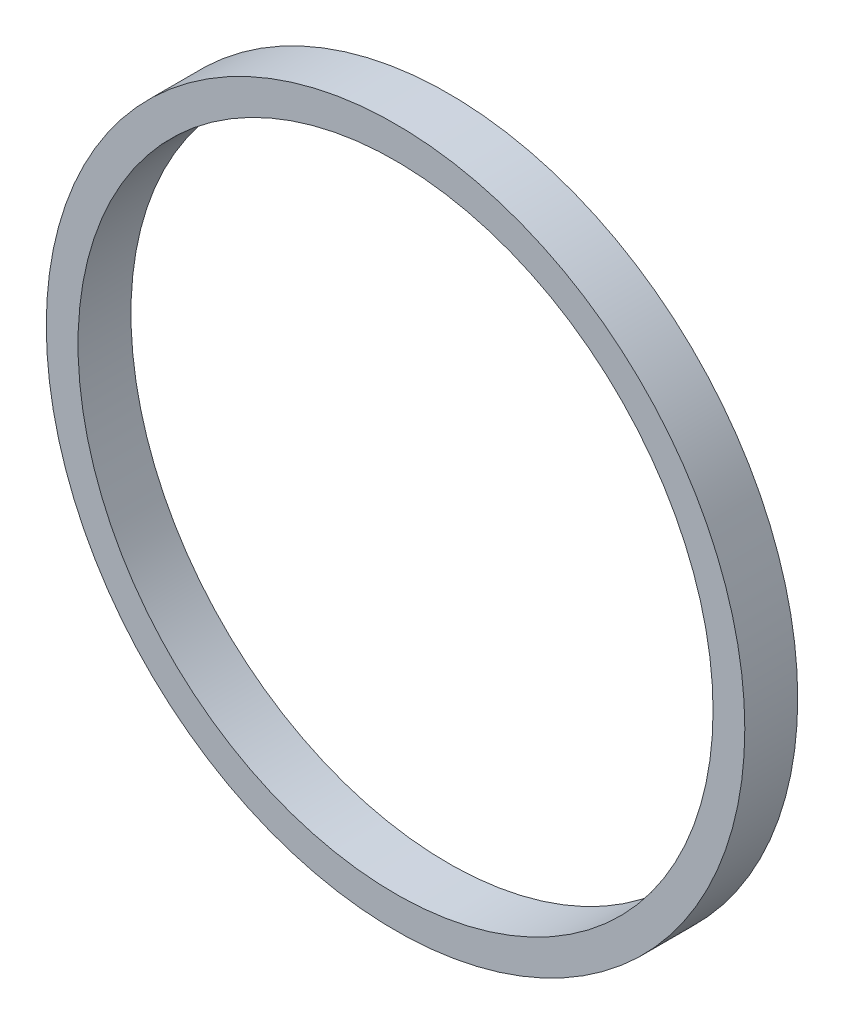
from build123d import *

# Parameters (mm, degrees)
SKETCH1_R           = 33
SKETCH1_R_2         = 30
BOSS_EXTRUDE1_DEPTH = 5


with BuildPart() as part:
    # Sketch1 → Boss-Extrude1 (new body)
    with BuildSketch(Plane.XY):
        with Locations((-0.745995021, 0)):
            Circle(SKETCH1_R)
        with Locations((-0.745995021, 0)):
            Circle(SKETCH1_R_2, mode=Mode.SUBTRACT)
    extrude(amount=BOSS_EXTRUDE1_DEPTH)


solid = part.part
